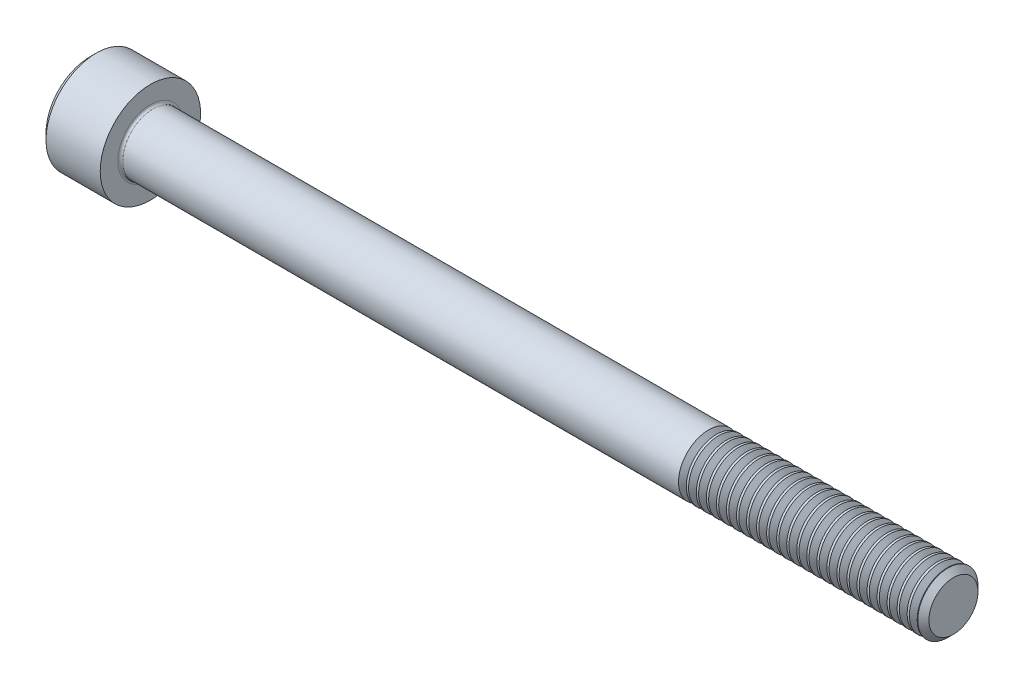
from build123d import *

# Parameters (mm, degrees)
FILLET1_R       = 0.25
HEX_2_DEPTH     = 3
THDSCHPAT_COUNT = 24
THDSCHPAT_PITCH = 1


with BuildPart() as part:
    # BodySke → Base-Revolve (revolve)
    with BuildSketch(Plane.XY, mode=Mode.PRIVATE) as base_revolve_sk:
        Polygon((0, 0), (0, 4.4), (0.6, 5), (6, 5), (6, 3), (85.4455, 3), (86, 2.4455), (86, 0), align=None)
    revolve(base_revolve_sk.sketch.rotate(Axis((-31.75, 0, 0), (1, 0, 0)), 90), axis=Axis((-31.75, 0, 0), (1, 0, 0)))

    # Fillet1
    fillet1_edges = [part.edges().sort_by_distance(p)[0] for p in [
        (6, 0, -3),
    ]]
    fillet(fillet1_edges, radius=FILLET1_R)

    # Sketch2 → Hex-PreBroach (revolve, cut)
    with BuildSketch(Plane.XY, mode=Mode.PRIVATE) as hex_prebroach_sk:
        Polygon((0, 2.542), (3, 2.542), (4.467624384, 0), (0, 0), align=None)
    revolve(hex_prebroach_sk.sketch.rotate(Axis((0, 0, 0), (1, 0, 0)), 90), axis=Axis((0, 0, 0), (1, 0, 0)), mode=Mode.SUBTRACT)

    # Sketch3 → Hex 2 (cut)
    with BuildSketch(Plane(origin=(0, 0, 0), x_dir=(0, 0.500000000000001, 0.866025403784438), z_dir=(-1, 0, 0))):
        Polygon((1.467624384, 2.542), (-1.467624384, 2.542), (-2.935248769, 0), (-1.467624384, -2.542), (1.467624384, -2.542), (2.935248769, 0), align=None)
    extrude(amount=-HEX_2_DEPTH, mode=Mode.SUBTRACT)

    # ThdSchSke → ThreadSchematic (revolve, cut)
    with BuildSketch(Plane.XY):
        Polygon((62, -2.4455), (61.61173492, -3), (61.61173492, -3.75), (62.38826508, -3.75), (62.38826508, -3), align=None)
    threadschematic = revolve(axis=Axis((-3.175, 0, 0), (1, 0, 0)), mode=Mode.SUBTRACT)

    # ThdSchPat: ThreadSchematic ×24
    with Locations(*[(i * THDSCHPAT_PITCH, 0, 0) for i in range(1, THDSCHPAT_COUNT)]):
        add(threadschematic, mode=Mode.SUBTRACT)


solid = part.part
